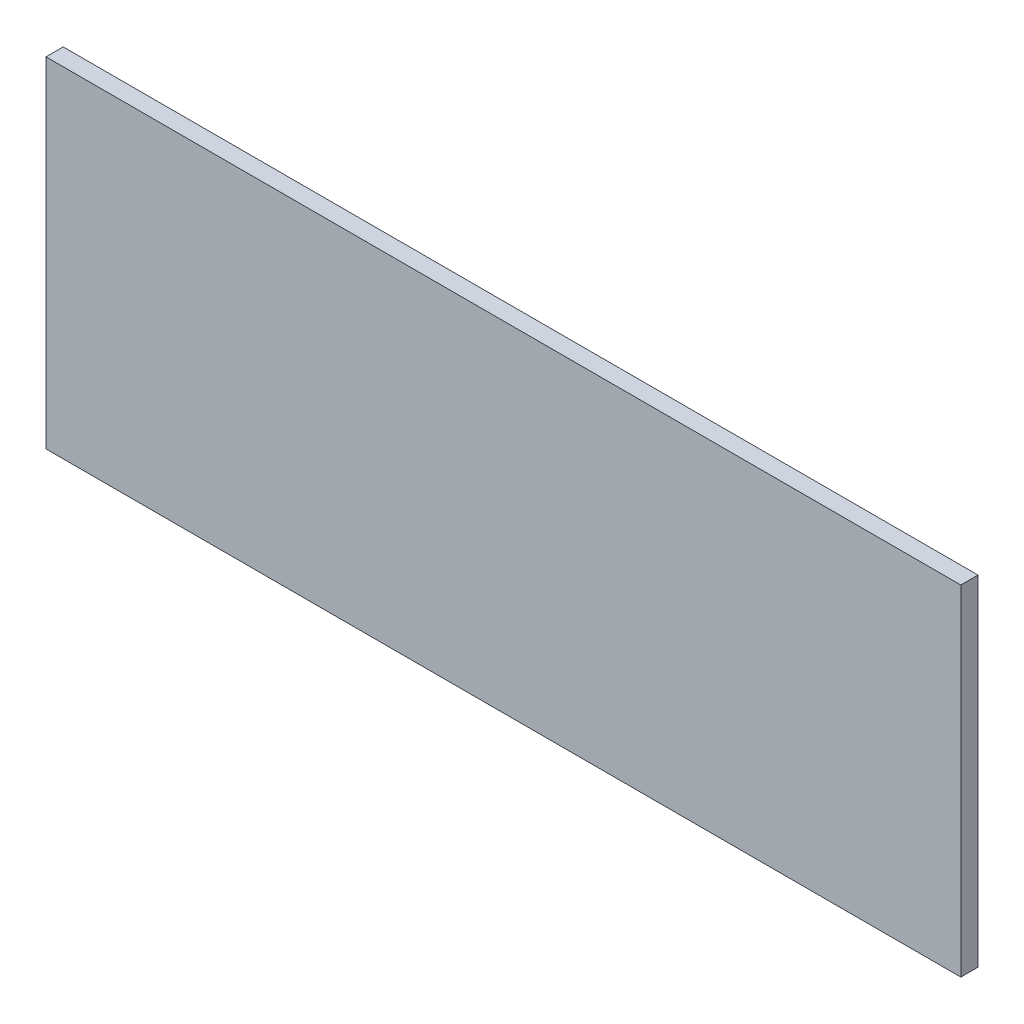
from build123d import *

# Parameters (mm, degrees)
ESQUISSE1_W        = 319
ESQUISSE1_H        = 118.414906094
BOSS_EXTRU_1_DEPTH = 6


with BuildPart() as part:
    # Esquisse1 → Boss.-Extru.1 (new body)
    with BuildSketch(Plane.XY):
        with Locations((-153.5, -53.207453047)):
            Rectangle(ESQUISSE1_W, ESQUISSE1_H)
    extrude(amount=BOSS_EXTRU_1_DEPTH)


solid = part.part
